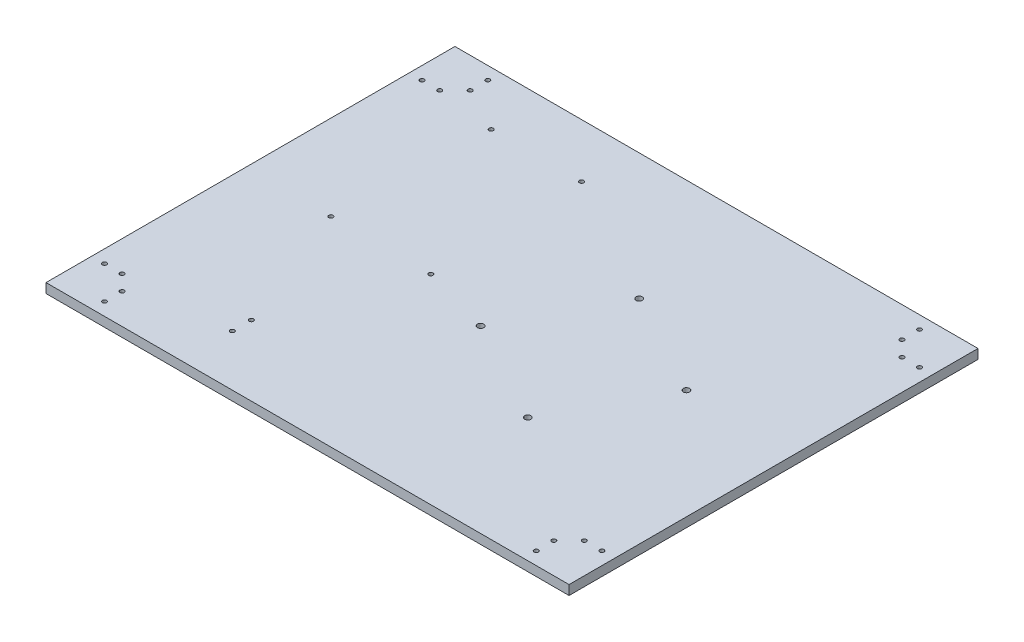
from build123d import *

# Parameters (mm, degrees)
SCHIZZO1_W                   = 550
SCHIZZO1_H                   = 430
ESTRUSIONE_ESTRUSIONE1_DEPTH = 10
SCHIZZO2_R                   = 2.25
TAGLIO_ESTRUSIONE1_DEPTH     = 20
SCHIZZO4_R                   = 3.3
TAGLIO_ESTRUSIONE2_DEPTH     = 10
SCHIZZO5_R                   = 2.25
TAGLIO_ESTRUSIONE3_DEPTH     = 10
SCHIZZO7_R                   = 2.25
TAGLIO_ESTRUSIONE4_DEPTH     = 10


with BuildPart() as part:
    # Schizzo1 → Estrusione-Estrusione1 (new body)
    with BuildSketch(Plane(origin=(0, 0, 0), x_dir=(1, 0, 0), z_dir=(0, 1, 0))):
        Rectangle(SCHIZZO1_W, SCHIZZO1_H)
    extrude(amount=ESTRUSIONE_ESTRUSIONE1_DEPTH)

    # Schizzo2 → Taglio-Estrusione1 (cut)
    with BuildSketch(Plane(origin=(0, 10, 0), x_dir=(1, 0, 0), z_dir=(0, 1, 0))):
        with Locations(Location((-227, 201.5, 0), (0, 0, 270))):
            Circle(SCHIZZO2_R)
        with Locations(Location((-227, 183, 0), (0, 0, 270))):
            Circle(SCHIZZO2_R)
        with Locations(Location((-243, 167, 0), (0, 0, 270))):
            Circle(SCHIZZO2_R)
        with Locations(Location((-261.5, 167, 0), (0, 0, 270))):
            Circle(SCHIZZO2_R)
        with Locations(Location((227, 201.5, 0), (0, 0, 270))):
            Circle(SCHIZZO2_R)
        with Locations(Location((227, 183, 0), (0, 0, 270))):
            Circle(SCHIZZO2_R)
        with Locations(Location((243, 167, 0), (0, 0, 270))):
            Circle(SCHIZZO2_R)
        with Locations(Location((261.5, 167, 0), (0, 0, 270))):
            Circle(SCHIZZO2_R)
        with Locations(Location((261.5, -167, 0), (0, 0, 270))):
            Circle(SCHIZZO2_R)
        with Locations(Location((243, -167, 0), (0, 0, 270))):
            Circle(SCHIZZO2_R)
        with Locations(Location((227, -183, 0), (0, 0, 270))):
            Circle(SCHIZZO2_R)
        with Locations(Location((227, -201.5, 0), (0, 0, 270))):
            Circle(SCHIZZO2_R)
        with Locations(Location((-227, -201.5, 0), (0, 0, 270))):
            Circle(SCHIZZO2_R)
        with Locations(Location((-227, -183, 0), (0, 0, 270))):
            Circle(SCHIZZO2_R)
        with Locations(Location((-243, -167, 0), (0, 0, 270))):
            Circle(SCHIZZO2_R)
        with Locations(Location((-261.5, -167, 0), (0, 0, 270))):
            Circle(SCHIZZO2_R)
    extrude(amount=-TAGLIO_ESTRUSIONE1_DEPTH, mode=Mode.SUBTRACT)

    # Schizzo4 → Taglio-Estrusione2 (cut)
    with BuildSketch(Plane(origin=(0, 10, 0), x_dir=(1, 0, 0), z_dir=(0, 1, 0))):
        with Locations(Location((101.151165148, -84.526742387, 0), (0, 0, 270))):
            Circle(SCHIZZO4_R)
        with Locations(Location((159.727005387, 23.671552148, 0), (0, 0, 270))):
            Circle(SCHIZZO4_R)
        with Locations(Location((51.528710852, 82.247392387, 0), (0, 0, 270))):
            Circle(SCHIZZO4_R)
        with Locations(Location((-7.047129387, -25.950902148, 0), (0, 0, 270))):
            Circle(SCHIZZO4_R)
    extrude(amount=-TAGLIO_ESTRUSIONE2_DEPTH, mode=Mode.SUBTRACT)

    # Schizzo5 → Taglio-Estrusione3 (cut)
    with BuildSketch(Plane.XZ):
        with Locations(Location((-132.921607377, 161.135242981, 0), (0, 0, 270))):
            Circle(SCHIZZO5_R)
        with Locations(Location((-132.921607377, 141.135242981, 0), (0, 0, 270))):
            Circle(SCHIZZO5_R)
    extrude(amount=-TAGLIO_ESTRUSIONE3_DEPTH, mode=Mode.SUBTRACT)

    # Schizzo7 → Taglio-Estrusione4 (cut)
    with BuildSketch(Plane(origin=(0, 10, 0), x_dir=(1, 0, 0), z_dir=(0, 1, 0))):
        with Locations(Location((-180.379679, 158.5, 0), (0, 0, 270))):
            Circle(SCHIZZO7_R)
        with Locations(Location((-85.379679, 158.5, 0), (0, 0, 270))):
            Circle(SCHIZZO7_R)
        with Locations(Location((-80.379679, -5, 0), (0, 0, 270))):
            Circle(SCHIZZO7_R)
        with Locations(Location((-185.379679, -5, 0), (0, 0, 270))):
            Circle(SCHIZZO7_R)
    extrude(amount=-TAGLIO_ESTRUSIONE4_DEPTH, mode=Mode.SUBTRACT)


solid = part.part
